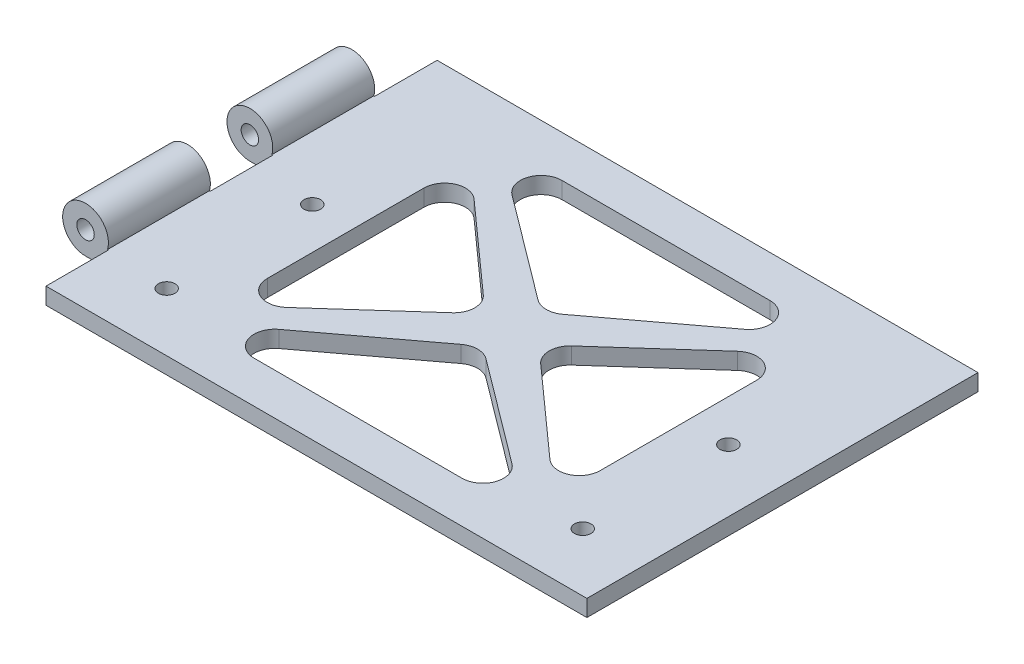
from build123d import *

# Parameters (mm, degrees)
SKETCH_1_W           = 130
SKETCH_1_H           = 94
EXTRUDE_1_DEPTH      = 4
EXTRUDE_2_DEPTH      = 32
EXTRUDE_2_DEPTH_BACK = 32
SKETCH_4_R           = 2.1
CUT_EXTRUDE_1_DEPTH  = 122.379569945
SKETCH_10_W          = 11
SKETCH_10_H          = 15
CUT_EXTRUDE_2_DEPTH  = 24
CUT_EXTRUDE_3_DEPTH  = 10
SKETCH_12_R          = 2
CUT_EXTRUDE_4_DEPTH  = 10


with BuildPart() as part:
    # Эскиз1 → Бобышка-Вытянуть1 (new body)
    with BuildSketch(Plane(origin=(0, 0, 0), x_dir=(1, 0, 0), z_dir=(0, 1, 0))):
        Rectangle(SKETCH_1_W, SKETCH_1_H)
    extrude(amount=EXTRUDE_1_DEPTH)

    # Эскиз2 → Бобышка-Вытянуть2 (add, two sides: drawn at the far end of the back side and taken through both)
    with BuildSketch(Plane.XY.offset(-EXTRUDE_2_DEPTH_BACK)):
        with BuildLine():
            Line((-65, 4), (-65.208497378, 4))
            ThreePointArc((-65.208497378, 4), (-73.81662479, 9.887482194), (-70.5, 0))
            Line((-70.5, 0), (-65, 0))
            Line((-65, 0), (-65, 4))
        make_face()
    extrude(amount=EXTRUDE_2_DEPTH + EXTRUDE_2_DEPTH_BACK)

    # Эскиз4 → Вырез-Вытянуть1 (cut, through all)
    with BuildSketch(Plane.XY.offset(47)):
        with Locations((-70.5, 5.5)):
            Circle(SKETCH_4_R)
    extrude(amount=-CUT_EXTRUDE_1_DEPTH, mode=Mode.SUBTRACT)

    # Эскиз10 → Вырез-Вытянуть2 (cut)
    with BuildSketch(Plane(origin=(0, 0, 0), x_dir=(1, 0, 0), z_dir=(0, 1, 0))):
        with Locations((-70.5, 0)):
            Rectangle(SKETCH_10_W, SKETCH_10_H)
    extrude(amount=CUT_EXTRUDE_2_DEPTH, mode=Mode.SUBTRACT)

    # Эскиз11 → Вырез-Вытянуть3 (cut)
    with BuildSketch(Plane(origin=(0, 4, 0), x_dir=(1, 0, 0), z_dir=(0, 1, 0))):
        with BuildLine():
            Line((-25, 37), (25, 37))
            ThreePointArc((25, 37), (29.74341649, 33.58113883), (28, 28))
            Line((28, 28), (3, 9.25))
            ThreePointArc((3, 9.25), (0, 8.25), (-3, 9.25))
            Line((-3, 9.25), (-28, 28))
            ThreePointArc((-28, 28), (-29.74341649, 33.58113883), (-25, 37))
        make_face()
        with BuildLine():
            Line((-3, -9.25), (-28, -28))
            ThreePointArc((-28, -28), (-29.74341649, -33.58113883), (-25, -37))
            Line((-25, -37), (25, -37))
            ThreePointArc((25, -37), (29.74341649, -33.58113883), (28, -28))
            Line((28, -28), (3, -9.25))
            ThreePointArc((3, -9.25), (0, -8.25), (-3, -9.25))
        make_face()
        with BuildLine():
            Line((-10.625647004, 3.726779962), (-31.666666667, 22.546440075))
            ThreePointArc((-31.666666667, 22.546440075), (-37.041241452, 23.384014758), (-40, 18.819660113))
            Line((-40, 18.819660113), (-40, -18.819660113))
            ThreePointArc((-40, -18.819660113), (-37.041241452, -23.384014758), (-31.666666667, -22.546440075))
            Line((-31.666666667, -22.546440075), (-10.625647004, -3.726779962))
            ThreePointArc((-10.625647004, -3.726779962), (-8.958980338, 0), (-10.625647004, 3.726779962))
        make_face()
        with BuildLine():
            Line((10.625647004, 3.726779962), (31.666666667, 22.546440075))
            ThreePointArc((31.666666667, 22.546440075), (37.041241452, 23.384014758), (40, 18.819660113))
            Line((40, 18.819660113), (40, -18.819660113))
            ThreePointArc((40, -18.819660113), (37.041241452, -23.384014758), (31.666666667, -22.546440075))
            Line((31.666666667, -22.546440075), (10.625647004, -3.726779962))
            ThreePointArc((10.625647004, -3.726779962), (8.958980338, 0), (10.625647004, 3.726779962))
        make_face()
    extrude(amount=-CUT_EXTRUDE_3_DEPTH, mode=Mode.SUBTRACT)

    # Эскиз12 → Вырез-Вытянуть4 (cut)
    with BuildSketch(Plane(origin=(0, 4, 0), x_dir=(1, 0, 0), z_dir=(0, 1, 0))):
        with Locations(Location((-50, 2, 0), (0, 0, 270))):
            Circle(SKETCH_12_R)
        with Locations(Location((50, 2, 0), (0, 0, 270))):
            Circle(SKETCH_12_R)
        with Locations(Location((50, -33, 0), (0, 0, 270))):
            Circle(SKETCH_12_R)
        with Locations(Location((-50, -33, 0), (0, 0, 270))):
            Circle(SKETCH_12_R)
    extrude(amount=-CUT_EXTRUDE_4_DEPTH, mode=Mode.SUBTRACT)


solid = part.part
